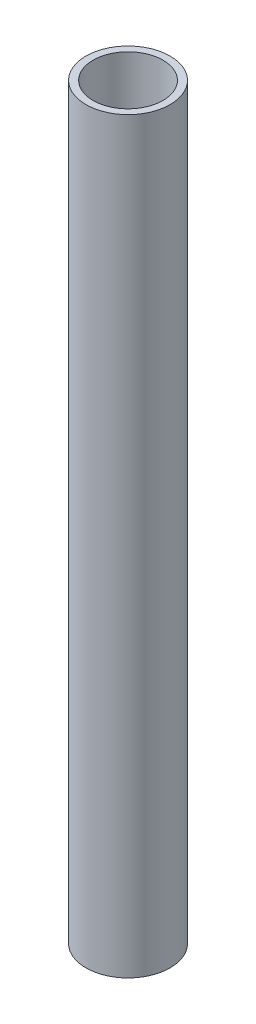
from build123d import *

# Parameters (mm, degrees)
SKETCH1_R           = 21.082
SKETCH1_R_2         = 17.526
BOSS_EXTRUDE1_DEPTH = 374.65


with BuildPart() as part:
    # Sketch1 → Boss-Extrude1 (new body)
    with BuildSketch(Plane(origin=(0, 0, 0), x_dir=(1, 0, 0), z_dir=(0, 1, 0))):
        with Locations(Location((0, 0, 0), (0, 0, 90))):
            Circle(SKETCH1_R)
        with Locations(Location((0, 0, 0), (0, 0, 90))):
            Circle(SKETCH1_R_2, mode=Mode.SUBTRACT)
    extrude(amount=BOSS_EXTRUDE1_DEPTH)


solid = part.part
